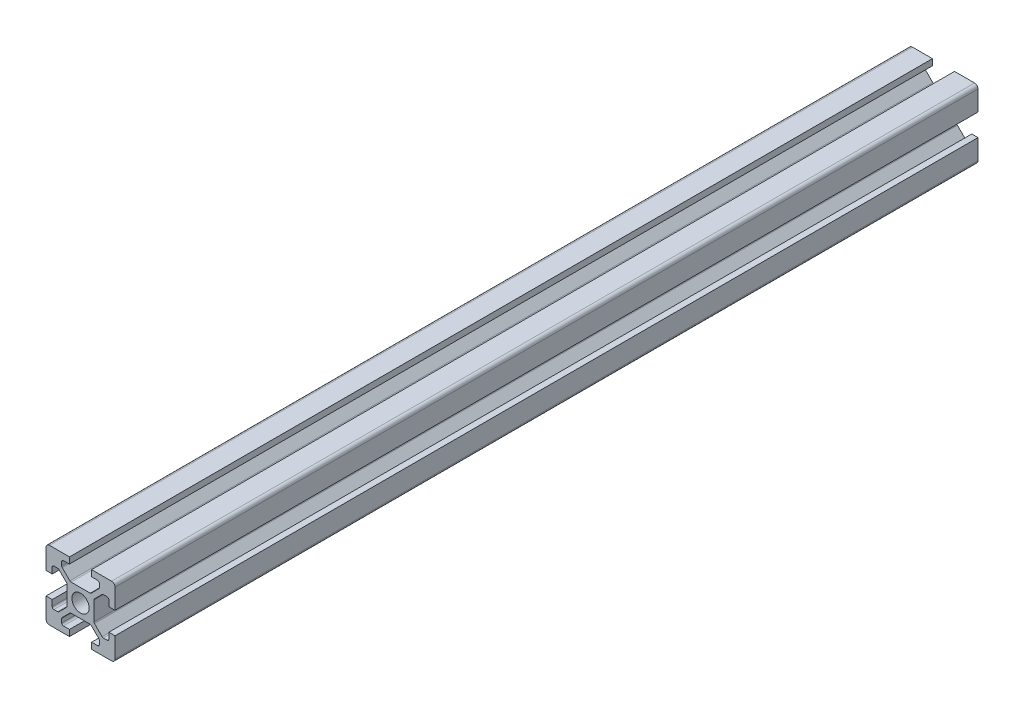
from build123d import *

# Parameters (mm, degrees)
SKETCH1_R           = 2.5
BOSS_EXTRUDE1_DEPTH = 250
FILLET1_R           = 1
FILLET2_R           = 0.5
FILLET3_R           = 0.5
FILLET4_R           = 0.5
FILLET5_R           = 0.5


with BuildPart() as part:
    # Sketch1 → Boss-Extrude1 (new body)
    with BuildSketch(Plane.XY):
        Polygon((13.2, 0), (13.2, 1.8), (15.45, 1.8), (15.45, 3.6), (12.95, 6.1), (7.05, 6.1), (4.55, 3.6), (4.55, 1.8), (6.8, 1.8), (6.8, 0), (0, 0), (0, 6.8), (1.8, 6.8), (1.8, 4.55), (3.6, 4.55), (6.1, 7.05), (6.1, 12.95), (3.6, 15.45), (1.8, 15.45), (1.8, 13.2), (0, 13.2), (0, 20), (6.8, 20), (6.8, 18.2), (4.55, 18.2), (4.55, 16.4), (7.05, 13.9), (12.95, 13.9), (15.45, 16.4), (15.45, 18.2), (13.2, 18.2), (13.2, 20), (20, 20), (20, 13.2), (18.2, 13.2), (18.2, 15.45), (16.4, 15.45), (13.9, 12.95), (13.9, 7.05), (16.4, 4.55), (18.2, 4.55), (18.2, 6.8), (20, 6.8), (20, 0), align=None)
        with Locations((10, 10)):
            Circle(SKETCH1_R, mode=Mode.SUBTRACT)
    extrude(amount=BOSS_EXTRUDE1_DEPTH)

    # Fillet1
    fillet1_edges = [part.edges().sort_by_distance(p)[0] for p in [
        (0, 0, 125),
        (0, 20, 125),
        (20, 20, 125),
        (20, 0, 125),
    ]]
    fillet(fillet1_edges, radius=FILLET1_R)

    # Fillet2
    fillet2_edges = [part.edges().sort_by_distance(p)[0] for p in [
        (4.55, 18.2, 125),
        (4.55, 16.4, 125),
        (7.05, 13.9, 125),
        (12.95, 13.9, 125),
        (15.45, 16.4, 125),
        (15.45, 18.2, 125),
    ]]
    fillet(fillet2_edges, radius=FILLET2_R)

    # Fillet3
    fillet3_edges = [part.edges().sort_by_distance(p)[0] for p in [
        (18.2, 15.45, 125),
        (16.4, 15.45, 125),
        (13.9, 12.95, 125),
        (13.9, 7.05, 125),
        (16.4, 4.55, 125),
        (18.2, 4.55, 125),
    ]]
    fillet(fillet3_edges, radius=FILLET3_R)

    # Fillet4
    fillet4_edges = [part.edges().sort_by_distance(p)[0] for p in [
        (1.8, 4.55, 125),
        (3.6, 4.55, 125),
        (6.1, 7.05, 125),
        (6.1, 12.95, 125),
        (3.6, 15.45, 125),
        (1.8, 15.45, 125),
    ]]
    fillet(fillet4_edges, radius=FILLET4_R)

    # Fillet5
    fillet5_edges = [part.edges().sort_by_distance(p)[0] for p in [
        (15.45, 1.8, 125),
        (15.45, 3.6, 125),
        (12.95, 6.1, 125),
        (7.05, 6.1, 125),
        (4.55, 3.6, 125),
        (4.55, 1.8, 125),
    ]]
    fillet(fillet5_edges, radius=FILLET5_R)


solid = part.part
